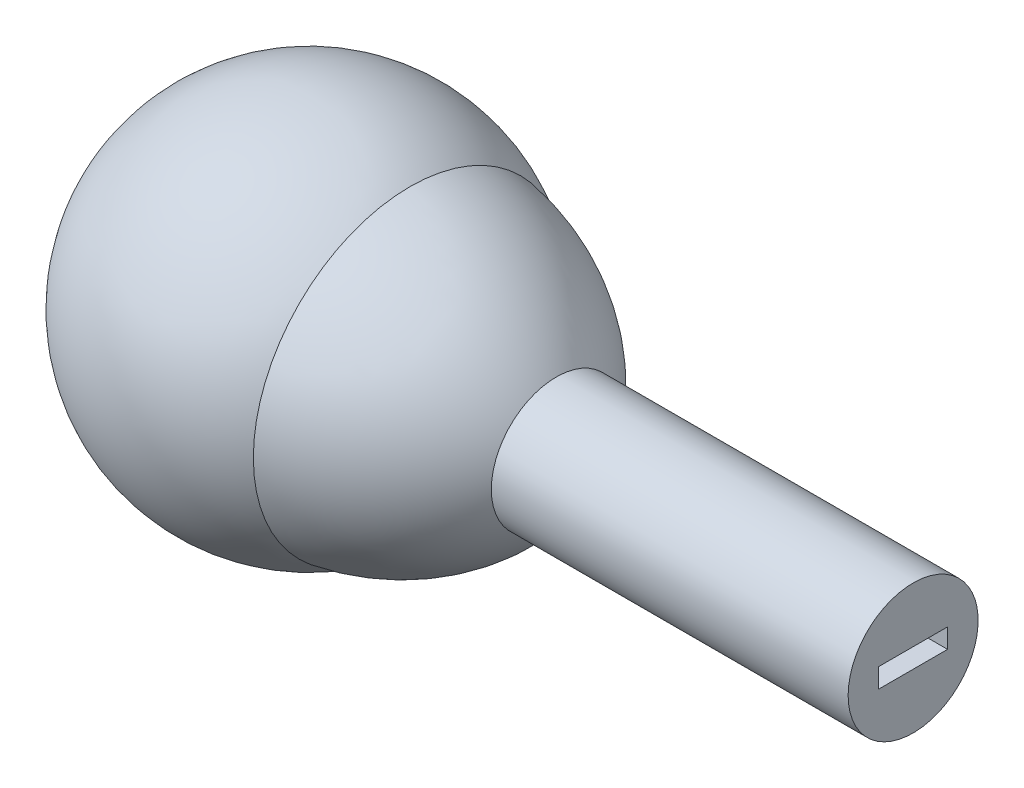
from build123d import *

# Parameters (mm, degrees)
SKETCH_2_W          = 5.3
SKETCH_2_H          = 1.5
CUT_EXTRUDE_2_DEPTH = 12


with BuildPart() as part:
    # 草图1 → 旋转4 (revolve)
    with BuildSketch(Plane.XY, mode=Mode.PRIVATE) as revolve_4_sk:
        with BuildLine():
            Line((-2.448374643, 5), (25, 5))
            Line((25, 5), (25, 0))
            Line((25, 0), (-35.778219949, 0))
            ThreePointArc((-35.778219949, 0), (-28.317806715, 12.571478645), (-13.708775535, 12.046075068))
            ThreePointArc((-13.708775535, 12.046075068), (-7.374475352, 9.64826615), (-2.448374643, 5))
        make_face()
    revolve(revolve_4_sk.sketch.rotate(Axis((-28.187562351, 0, 0), (1, 0, 0)), 90), axis=Axis((-28.187562351, 0, 0), (1, 0, 0)))

    # 草图2 → 切除-拉伸2 (cut)
    with BuildSketch(Plane(origin=(25, 0, 0), x_dir=(0, 0, -1), z_dir=(1, 0, 0))):
        Rectangle(SKETCH_2_W, SKETCH_2_H)
    extrude(amount=-CUT_EXTRUDE_2_DEPTH, mode=Mode.SUBTRACT)


solid = part.part
